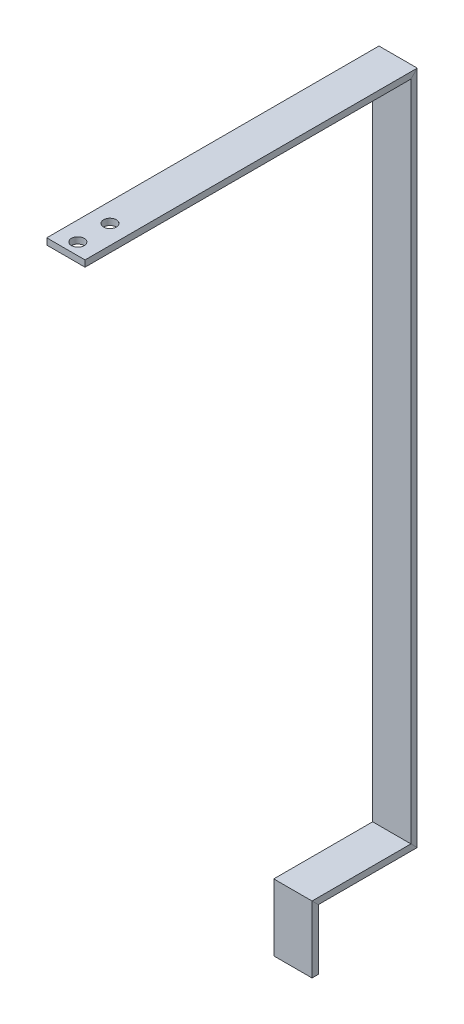
from build123d import *

# Parameters (mm, degrees)
CROQUIS1_W              = 38.1
CROQUIS1_H              = 850.5
SALIENTE_EXTRUIR1_DEPTH = 6.31
CROQUIS2_W              = 38.1
CROQUIS2_H              = 6.31
SALIENTE_EXTRUIR2_DEPTH = 70
CROQUIS3_W              = 38.1
CROQUIS3_H              = 6.31
SALIENTE_EXTRUIR3_DEPTH = 578
CROQUIS4_R              = 6.935856655
CORTAR_EXTRUIR1_DEPTH   = 7
CROQUIS5_W              = 38.1
CROQUIS5_H              = 687.72607772
CORTAR_EXTRUIR2_DEPTH   = 10
CROQUIS6_W              = 38.1
CROQUIS6_H              = 6.31
CROQUIS8_W              = 368.89
CROQUIS8_H              = 6.31
CORTAR_EXTRUIR3_DEPTH   = 147
CROQUIS9_R              = 6.35
CORTAR_EXTRUIR4_DEPTH   = 6.31
CROQUIS10_W             = 38.1
CROQUIS10_H             = 6.31


with BuildPart() as part:
    # Croquis1 → Saliente-Extruir1 (new body)
    with BuildSketch(Plane.XY):
        Rectangle(CROQUIS1_W, CROQUIS1_H)
    extrude(amount=SALIENTE_EXTRUIR1_DEPTH)

    # Croquis2 → Saliente-Extruir2 (add)
    with BuildSketch(Plane.XY.offset(6.31)):
        with Locations((0, -422.095)):
            Rectangle(CROQUIS2_W, CROQUIS2_H)
    extrude(amount=SALIENTE_EXTRUIR2_DEPTH)

    # Croquis3 → Saliente-Extruir3 (add)
    with BuildSketch(Plane.XY.offset(6.31)):
        with Locations((0, -265.63107772)):
            Rectangle(CROQUIS3_W, CROQUIS3_H)
    extrude(amount=-SALIENTE_EXTRUIR3_DEPTH)

    # Croquis4 → Cortar-Extruir1 (cut)
    with BuildSketch(Plane(origin=(0, -262.47607772, 0), x_dir=(1, 0, 0), z_dir=(0, 1, 0))):
        with Locations(Location((0, 536.981534281, 0), (0, 0, 270))):
            Circle(CROQUIS4_R)
    extrude(amount=-CORTAR_EXTRUIR1_DEPTH, mode=Mode.SUBTRACT)

    # Croquis5 → Cortar-Extruir2 (cut)
    with BuildSketch(Plane(origin=(0, 0, 0), x_dir=(-1, 0, 0), z_dir=(0, 0, -1))):
        with Locations((0, 81.38696114)):
            Rectangle(CROQUIS5_W, CROQUIS5_H)
    extrude(amount=-CORTAR_EXTRUIR2_DEPTH, mode=Mode.SUBTRACT)

    # Barrer1: sweep along a curve in space
    with BuildLine() as barrer1_path:
        Line((0, -262.47607772, -199.645), (0, 386.85392228, -199.645))
        Line((0, 386.85392228, -199.645), (0, 386.85392228, 127.905))
    # Croquis6 → Barrer1 (sweep)
    with BuildSketch(Plane(origin=(0, -262.47607772, 0), x_dir=(1, 0, 0), z_dir=(0, 1, 0))):
        with Locations((0, 199.645)):
            Rectangle(CROQUIS6_W, CROQUIS6_H)
    sweep(path=barrer1_path.line, transition=Transition.RIGHT)

    # Croquis8 → Cortar-Extruir3 (cut)
    with BuildSketch(Plane(origin=(19.05, 0, 0), x_dir=(0, 0, -1), z_dir=(1, 0, 0))):
        Polygon((196.49, -262.47607772), (196.49, -268.78607772), (196.49, -444.307673596), (-90.834600665, -444.307673596), (-90.834600665, -262.47607772), align=None)
        with Locations((387.245, -265.63107772)):
            Rectangle(CROQUIS8_W, CROQUIS8_H)
    extrude(amount=-CORTAR_EXTRUIR3_DEPTH, mode=Mode.SUBTRACT)

    # Croquis9 → Cortar-Extruir4 (cut)
    with BuildSketch(Plane(origin=(0, 390.00892228, 0), x_dir=(1, 0, 0), z_dir=(0, 1, 0))):
        with Locations(Location((0, -84.010000001, 0), (0, 0, 180))):
            Circle(CROQUIS9_R)
        with Locations(Location((0, -116.010000001, 0), (0, 0, 180))):
            Circle(CROQUIS9_R)
    extrude(amount=-CORTAR_EXTRUIR4_DEPTH, mode=Mode.SUBTRACT)

    # Barrer2: sweep along a curve in space
    with BuildLine() as barrer2_path:
        Line((0, -268.78607772, -199.645), (0, -278.78607772, -199.645))
        Line((0, -278.78607772, -199.645), (0, -278.78607772, -101.215))
        Line((0, -278.78607772, -101.215), (0, -342.02607772, -101.215))
    # Croquis10 → Barrer2 (sweep)
    with BuildSketch(Plane.XZ.offset(268.78607772)):
        with Locations((0, -199.645)):
            Rectangle(CROQUIS10_W, CROQUIS10_H)
    sweep(path=barrer2_path.line, transition=Transition.RIGHT)


solid = part.part
